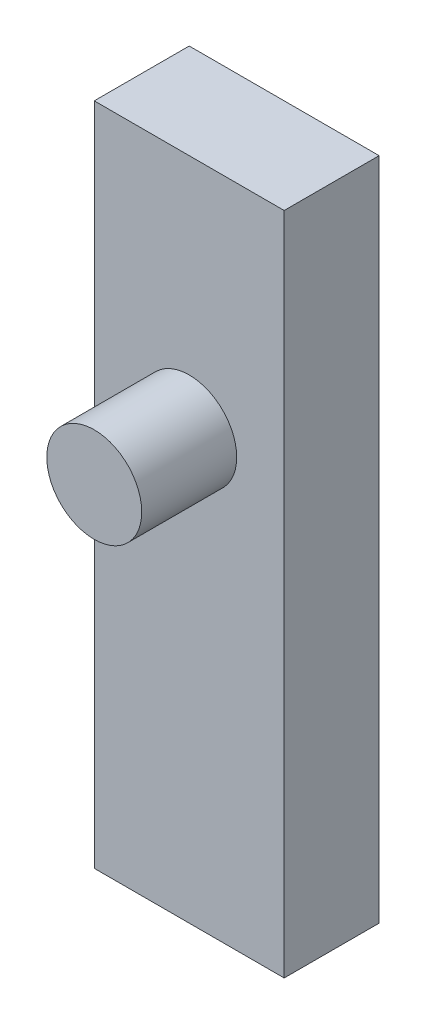
from build123d import *

# Parameters (mm, degrees)
SKETCH_1_W      = 20
SKETCH_1_H      = 70
EXTRUDE_1_DEPTH = 10
SKETCH_2_R      = 5
EXTRUDE_2_DEPTH = 10


with BuildPart() as part:
    # 草图1 → 凸台-拉伸1 (new body)
    with BuildSketch(Plane.XY):
        with Locations((10, -35)):
            Rectangle(SKETCH_1_W, SKETCH_1_H)
    extrude(amount=EXTRUDE_1_DEPTH)

    # 草图2 → 凸台-拉伸2 (add)
    with BuildSketch(Plane.XY.offset(10)):
        with Locations((10, -25)):
            Circle(SKETCH_2_R)
    extrude(amount=EXTRUDE_2_DEPTH)


solid = part.part
